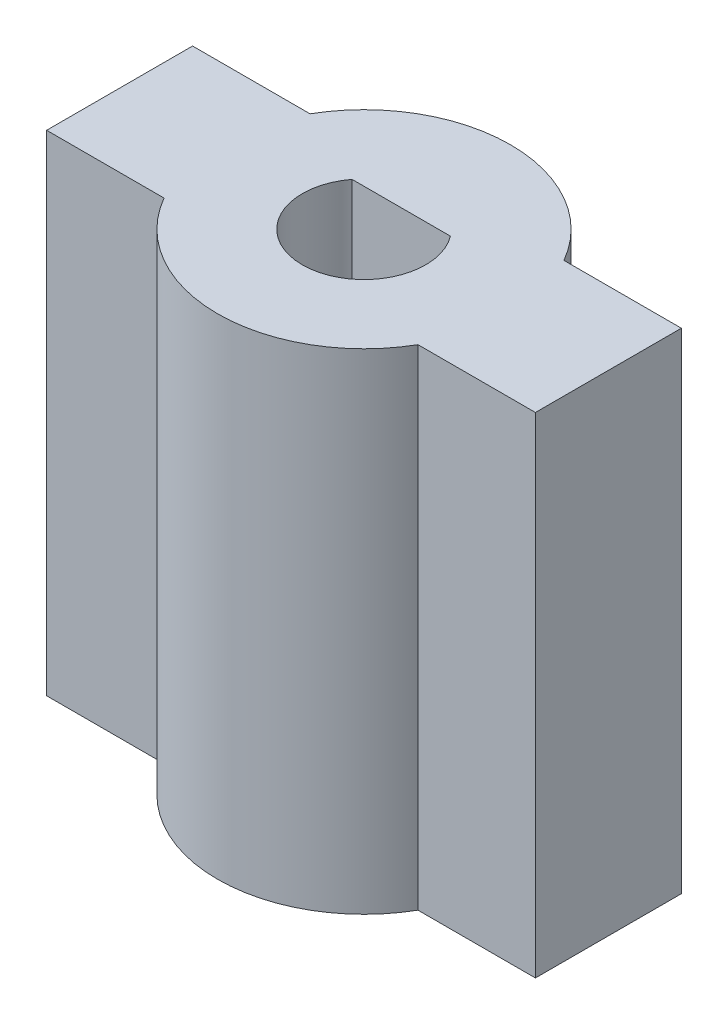
from build123d import *

# Parameters (mm, degrees)
EXTRUDE_3_DEPTH     = 20
CUT_EXTRUDE_4_DEPTH = 15
CUT_EXTRUDE_START   = -5
SKETCH_6_R          = 2.52
CUT_EXTRUDE_5_DEPTH = 5


with BuildPart() as part:
    # 草图1 → 凸台-拉伸3 (new body)
    with BuildSketch(Plane(origin=(0, 0, 0), x_dir=(1, 0, 0), z_dir=(0, 1, 0))):
        with BuildLine():
            Line((9.98, -2.98), (5.184592559, -2.98))
            ThreePointArc((5.184592559, -2.98), (0, -5.98), (-5.184592559, -2.98))
            Line((-5.184592559, -2.98), (-9.98, -2.98))
            Line((-9.98, -2.98), (-9.98, 2.98))
            Line((-9.98, 2.98), (-5.184592559, 2.98))
            ThreePointArc((-5.184592559, 2.98), (0, 5.98), (5.184592559, 2.98))
            Line((5.184592559, 2.98), (9.98, 2.98))
            Line((9.98, 2.98), (9.98, -2.98))
        make_face()
    extrude(amount=EXTRUDE_3_DEPTH)

    # 草图5 → 切除-拉伸4 (cut)
    with BuildSketch(Plane(origin=(0, 20, 0), x_dir=(1, 0, 0), z_dir=(0, 1, 0))):
        with BuildLine():
            Line((-2.009975124, 1.52), (2.009975124, 1.52))
            ThreePointArc((2.009975124, 1.52), (0, -2.52), (-2.009975124, 1.52))
        make_face()
    extrude(amount=-CUT_EXTRUDE_4_DEPTH, mode=Mode.SUBTRACT)

    # 草图6 → 切除-拉伸5 (cut)
    with BuildSketch(Plane.XZ.offset(CUT_EXTRUDE_START)):
        with Locations(Location((0, 0, 0), (0, 0, 217.097601801))):
            Circle(SKETCH_6_R)
    extrude(amount=CUT_EXTRUDE_5_DEPTH, mode=Mode.SUBTRACT)


solid = part.part
